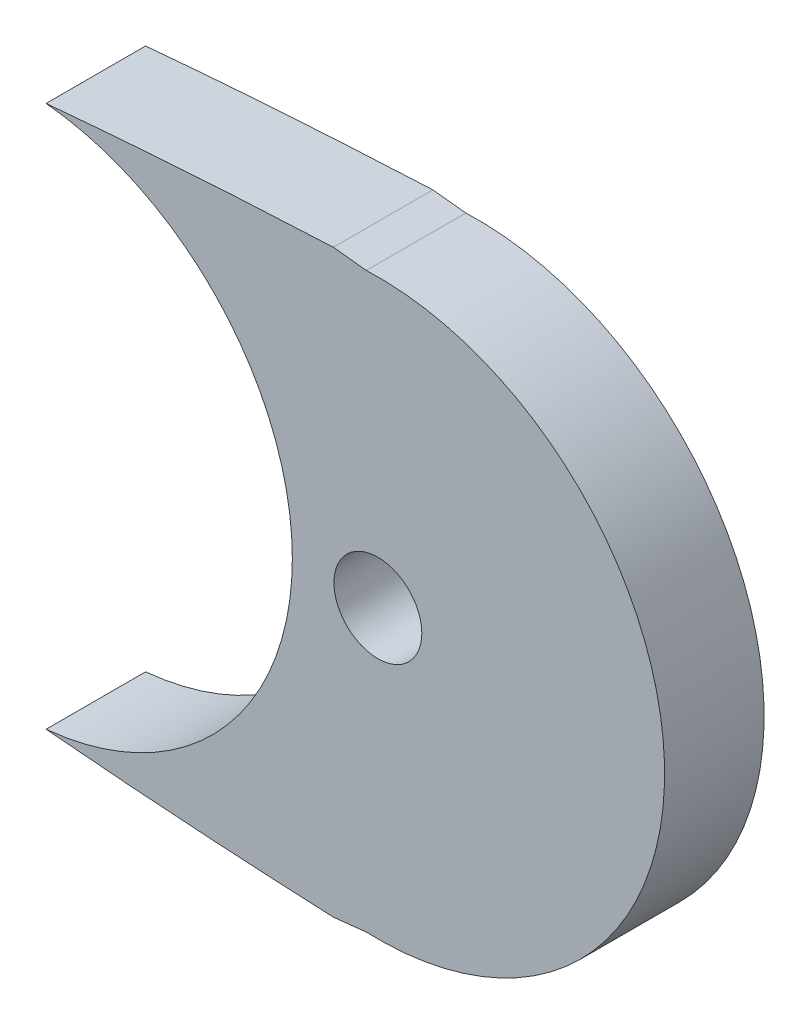
from build123d import *

# Parameters (mm, degrees)
SKETCH2_R           = 2.65
BOSS_EXTRUDE4_DEPTH = 6
CUT_EXTRUDE2_DEPTH  = 88.793483499


with BuildPart() as part:
    # Sketch2 → Boss-Extrude4 (new body)
    with BuildSketch(Plane.XY):
        with BuildLine():
            add(Edge.make_bspline(
                [(67.5, 17.578928476), (65.61016752, 17.502615465), (60.634413429, 17.271238409), (53.13057404, 16.789010877), (47.524682176, 16.292383273), (45, 16.035396523)],
                knots=[0.381536428, 0.381536428, 0.381536428, 0.381536428, 0.390812303, 0.405965006, 0.418410632, 0.418410632, 0.418410632, 0.418410632], degree=3))
            ThreePointArc((45, 16.035396523), (62.750493933, 0), (45, -16.035396523))
            add(Edge.make_bspline(
                [(45, -16.035396523), (47.524682176, -16.292383273), (53.13057404, -16.789010877), (60.634413429, -17.271238409), (65.61016752, -17.502615465), (67.5, -17.578928476)],
                knots=[0.581589368, 0.581589368, 0.581589368, 0.581589368, 0.594034994, 0.609187697, 0.618463572, 0.618463572, 0.618463572, 0.618463572], degree=3))
            ThreePointArc((67.5, -17.578928476), (85.803106629, 0), (67.5, 17.578928476))
        make_face()
        with Locations((68.209851787, 0)):
            Circle(SKETCH2_R, mode=Mode.SUBTRACT)
    extrude(amount=BOSS_EXTRUDE4_DEPTH)

    # Sketch4 → Cut-Extrude2 (cut, through all)
    with BuildSketch(Plane.XY.offset(6)):
        with BuildLine():
            Line((65.5273107, 17.495020066), (67.512104385, 17.279172769))
            ThreePointArc((67.512104385, 17.279172769), (85.503106629, 0), (67.512104385, -17.279172769))
            Line((67.512104385, -17.279172769), (65.5273107, -17.495020066))
            add(Edge.make_bspline(
                [(65.5273107, -17.495020066), (66.184811673, -17.524419912), (66.842377464, -17.55237313), (67.5, -17.578928476)],
                knots=[0.615235759, 0.615235759, 0.615235759, 0.615235759, 0.618463572, 0.618463572, 0.618463572, 0.618463572], degree=3))
            ThreePointArc((67.5, -17.578928476), (85.803106629, 0), (67.5, 17.578928476))
            add(Edge.make_bspline(
                [(67.5, 17.578928476), (66.842377464, 17.55237313), (66.184811673, 17.524419912), (65.5273107, 17.495020066)],
                knots=[0.381536428, 0.381536428, 0.381536428, 0.381536428, 0.384764241, 0.384764241, 0.384764241, 0.384764241], degree=3))
        make_face()
        with BuildLine():
            ThreePointArc((48.197537186, -16.3434678), (63.050493933, 0), (48.197537186, 16.3434678))
            add(Edge.make_bspline(
                [(48.197537186, 16.3434678), (47.131160592, 16.246385916), (46.065284113, 16.143831519), (45, 16.035396523)],
                knots=[0.413159228, 0.413159228, 0.413159228, 0.413159228, 0.418410632, 0.418410632, 0.418410632, 0.418410632], degree=3))
            ThreePointArc((45, 16.035396523), (62.750493933, 0), (45, -16.035396523))
            add(Edge.make_bspline(
                [(45, -16.035396523), (46.065284113, -16.143831519), (47.131160592, -16.246385916), (48.197537186, -16.3434678)],
                knots=[0.581589368, 0.581589368, 0.581589368, 0.581589368, 0.586840772, 0.586840772, 0.586840772, 0.586840772], degree=3))
        make_face()
    extrude(amount=-CUT_EXTRUDE2_DEPTH, mode=Mode.SUBTRACT)


solid = part.part
